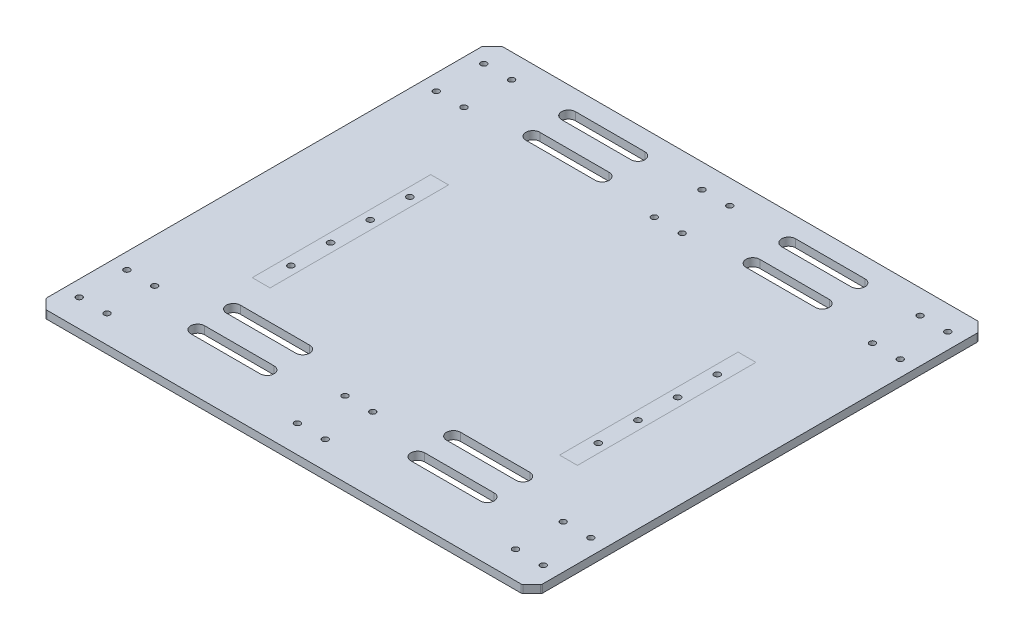
from build123d import *

# Parameters (mm, degrees)
SKETCH_1_W          = 250
SKETCH_1_H          = 230
EXTRUDE_1_DEPTH     = 4
SKETCH_5_R          = 1.55
CUT_EXTRUDE_4_DEPTH = 3
SKETCH_7_R          = 1.5
CUT_EXTRUDE_5_DEPTH = 170.899970571
SKETCH_8_W          = 250
SKETCH_8_H          = 8
CUT_EXTRUDE_6_DEPTH = 10
SKETCH_9_W          = 250
SKETCH_9_H          = 8
EXTRUDE_2_DEPTH     = 4
CHAMFER_1_SIZE      = 5
FILLET_1_R          = 1


with BuildPart() as part:
    # 草图1 → 凸台-拉伸1 (new body)
    with BuildSketch(Plane(origin=(0, 0, 0), x_dir=(1, 0, 0), z_dir=(0, 1, 0))):
        Rectangle(SKETCH_1_W, SKETCH_1_H)
    extrude(amount=EXTRUDE_1_DEPTH)

    # 草图5 → 切除-拉伸4 (cut)
    with BuildSketch(Plane(origin=(0, 4, 0), x_dir=(1, 0, 0), z_dir=(0, 1, 0))):
        with Locations(Location((77.5, -2, 0), (0, 0, 270))):
            Circle(SKETCH_5_R)
        with Locations(Location((77.5, 18, 0), (0, 0, 270))):
            Circle(SKETCH_5_R)
        with Locations(Location((77.5, -22, 0), (0, 0, 90))):
            Circle(SKETCH_5_R)
        with Locations(Location((77.5, -42, 0), (0, 0, 90))):
            Circle(SKETCH_5_R)
        with Locations(Location((-77.5, -42, 0), (0, 0, 270))):
            Circle(SKETCH_5_R)
        with Locations(Location((-77.5, -22, 0), (0, 0, 270))):
            Circle(SKETCH_5_R)
        with Locations(Location((-77.5, 18, 0), (0, 0, 90))):
            Circle(SKETCH_5_R)
        with Locations(Location((-77.5, -2, 0), (0, 0, 90))):
            Circle(SKETCH_5_R)
    extrude(amount=-CUT_EXTRUDE_4_DEPTH, mode=Mode.SUBTRACT)

    # 草图7 → 切除-拉伸5 (cut, through all)
    with BuildSketch(Plane(origin=(0, 4, 0), x_dir=(1, 0, 0), z_dir=(0, 1, 0))):
        with Locations(Location((-117.000000001, 94.78695798, 0), (0, 0, 270))):
            Circle(SKETCH_7_R)
        with Locations(Location((-117.000000001, 70.78695798, 0), (0, 0, 270))):
            Circle(SKETCH_7_R)
        with Locations(Location((-103.000000001, 70.78695798, 0), (0, 0, 270))):
            Circle(SKETCH_7_R)
        with Locations(Location((-103.000000001, 94.78695798, 0), (0, 0, 270))):
            Circle(SKETCH_7_R)
        with Locations(Location((-7, 94.786957979, 0), (0, 0, 270))):
            Circle(SKETCH_7_R)
        with Locations(Location((7, 94.786957979, 0), (0, 0, 270))):
            Circle(SKETCH_7_R)
        with Locations(Location((7, 70.786957979, 0), (0, 0, 270))):
            Circle(SKETCH_7_R)
        with Locations(Location((-7, 70.786957979, 0), (0, 0, 270))):
            Circle(SKETCH_7_R)
        with Locations(Location((116.999999999, 94.78695798, 0), (0, 0, 270))):
            Circle(SKETCH_7_R)
        with Locations(Location((116.999999999, 70.78695798, 0), (0, 0, 270))):
            Circle(SKETCH_7_R)
        with Locations(Location((102.999999999, 70.78695798, 0), (0, 0, 270))):
            Circle(SKETCH_7_R)
        with Locations(Location((102.999999999, 94.78695798, 0), (0, 0, 270))):
            Circle(SKETCH_7_R)
        with Locations(Location((103, -109.213042021, 0), (0, 0, 270))):
            Circle(SKETCH_7_R)
        with Locations(Location((117, -109.213042021, 0), (0, 0, 270))):
            Circle(SKETCH_7_R)
        with Locations(Location((117, -85.213042021, 0), (0, 0, 270))):
            Circle(SKETCH_7_R)
        with Locations(Location((103, -85.213042021, 0), (0, 0, 270))):
            Circle(SKETCH_7_R)
        with Locations(Location((7, -85.213042021, 0), (0, 0, 270))):
            Circle(SKETCH_7_R)
        with Locations(Location((7, -109.213042021, 0), (0, 0, 270))):
            Circle(SKETCH_7_R)
        with Locations(Location((-7, -85.213042021, 0), (0, 0, 270))):
            Circle(SKETCH_7_R)
        with Locations(Location((-7, -109.213042021, 0), (0, 0, 270))):
            Circle(SKETCH_7_R)
        with Locations(Location((-117, -85.213042021, 0), (0, 0, 270))):
            Circle(SKETCH_7_R)
        with Locations(Location((-103, -85.213042021, 0), (0, 0, 270))):
            Circle(SKETCH_7_R)
        with Locations(Location((-103, -109.213042021, 0), (0, 0, 270))):
            Circle(SKETCH_7_R)
        with Locations(Location((-117, -109.213042021, 0), (0, 0, 270))):
            Circle(SKETCH_7_R)
    extrude(amount=-CUT_EXTRUDE_5_DEPTH, mode=Mode.SUBTRACT)

    # 草图8 → 切除-拉伸6 (cut)
    with BuildSketch(Plane(origin=(0, 4, 0), x_dir=(1, 0, 0), z_dir=(0, 1, 0))):
        with BuildLine():
            Line((-73, 97), (-38, 97))
            ThreePointArc((-38, 97), (-34.5, 93.5), (-38, 90))
            Line((-38, 90), (-73, 90))
            ThreePointArc((-73, 90), (-76.5, 93.5), (-73, 97))
        make_face()
        with BuildLine():
            Line((-73, 79), (-38, 79))
            ThreePointArc((-38, 79), (-34.5, 75.5), (-38, 72))
            Line((-38, 72), (-73, 72))
            ThreePointArc((-73, 72), (-76.5, 75.5), (-73, 79))
        make_face()
        with BuildLine():
            Line((73, 97), (38, 97))
            ThreePointArc((38, 97), (34.5, 93.5), (38, 90))
            Line((38, 90), (73, 90))
            ThreePointArc((73, 90), (76.5, 93.5), (73, 97))
        make_face()
        with BuildLine():
            Line((73, 79), (38, 79))
            ThreePointArc((38, 79), (34.5, 75.5), (38, 72))
            Line((38, 72), (73, 72))
            ThreePointArc((73, 72), (76.5, 75.5), (73, 79))
        make_face()
        with BuildLine():
            Line((-73, -97), (-38, -97))
            ThreePointArc((-38, -97), (-34.5, -93.5), (-38, -90))
            Line((-38, -90), (-73, -90))
            ThreePointArc((-73, -90), (-76.5, -93.5), (-73, -97))
        make_face()
        with BuildLine():
            Line((-73, -79), (-38, -79))
            ThreePointArc((-38, -79), (-34.5, -75.5), (-38, -72))
            Line((-38, -72), (-73, -72))
            ThreePointArc((-73, -72), (-76.5, -75.5), (-73, -79))
        make_face()
        with BuildLine():
            Line((73, -97), (38, -97))
            ThreePointArc((38, -97), (34.5, -93.5), (38, -90))
            Line((38, -90), (73, -90))
            ThreePointArc((73, -90), (76.5, -93.5), (73, -97))
        make_face()
        with BuildLine():
            Line((73, -79), (38, -79))
            ThreePointArc((38, -79), (34.5, -75.5), (38, -72))
            Line((38, -72), (73, -72))
            ThreePointArc((73, -72), (76.5, -75.5), (73, -79))
        make_face()
        with Locations((0, 111)):
            Rectangle(SKETCH_8_W, SKETCH_8_H)
    extrude(amount=-CUT_EXTRUDE_6_DEPTH, mode=Mode.SUBTRACT)

    # 草图9 → 凸台-拉伸2 (add)
    with BuildSketch(Plane(origin=(0, 4, 0), x_dir=(1, 0, 0), z_dir=(0, 1, 0))):
        with Locations((0, -119)):
            Rectangle(SKETCH_9_W, SKETCH_9_H)
    extrude(amount=-EXTRUDE_2_DEPTH)

    # 倒角1
    chamfer_1_edges = [part.edges().sort_by_distance(p)[0] for p in [
        (-125, 2, -107),
        (125, 2, -107),
        (-125, 2, 123),
        (125, 2, 123),
    ]]
    chamfer(chamfer_1_edges, length=CHAMFER_1_SIZE)

    # 圆角1
    fillet_1_edges = [part.edges().sort_by_distance(p)[0] for p in [
        (-125, 2, -102),
        (-125, 2, 118),
        (120, 2, 123),
        (-120, 2, 123),
        (125, 2, 118),
        (125, 2, -102),
        (-120, 2, -107),
        (120, 2, -107),
    ]]
    fillet(fillet_1_edges, radius=FILLET_1_R)


solid = part.part
